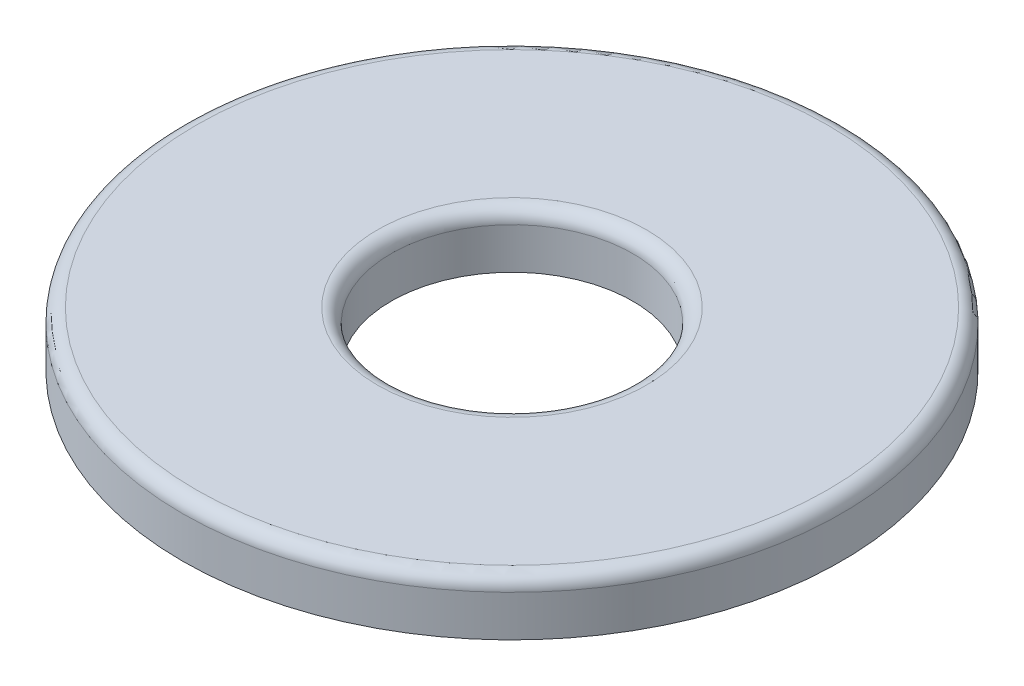
from build123d import *

# Parameters (mm, degrees)
SZKIC1_R                    = 6
SZKIC1_R_2                  = 2.2
DODANIE_WYCI_GNI_CIE1_DEPTH = 1
ZAOKR_GLENIE1_R             = 0.25


with BuildPart() as part:
    # Szkic1 → Dodanie-wyciągnięcie1 (new body)
    with BuildSketch(Plane(origin=(0, 0, 0), x_dir=(1, 0, 0), z_dir=(0, 1, 0))):
        with Locations(Location((0, 0, 0), (0, 0, 270))):
            Circle(SZKIC1_R)
        with Locations(Location((0, 0, 0), (0, 0, 270))):
            Circle(SZKIC1_R_2, mode=Mode.SUBTRACT)
    extrude(amount=DODANIE_WYCI_GNI_CIE1_DEPTH)

    # Zaokrąglenie1
    zaokr_glenie1_edges = [part.edges().sort_by_distance(p)[0] for p in [
        (0, 1, -6),
        (0, 1, -2.2),
    ]]
    fillet(zaokr_glenie1_edges, radius=ZAOKR_GLENIE1_R)


solid = part.part
